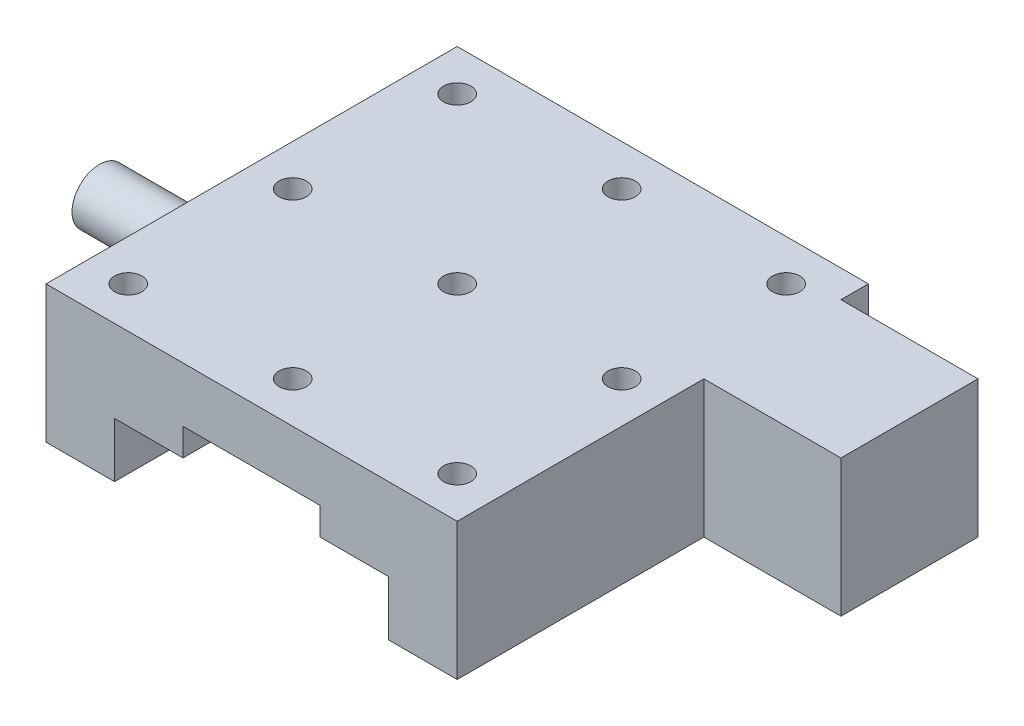
from build123d import *

# Parameters (mm, degrees)
SKETCH_1_W          = 30
SKETCH_1_H          = 30
EXTRUDE_1_DEPTH     = 10
CUT_EXTRUDE_1_DEPTH = 44.588989435
SKETCH_3_R          = 1
CUT_EXTRUDE_2_DEPTH = 3
SKETCH_4_W          = 10
SKETCH_4_H          = 10
EXTRUDE_2_DEPTH     = 10
SKETCH_5_R          = 1
EXTRUDE_3_DEPTH     = 1.6
SKETCH_6_R          = 2
EXTRUDE_4_DEPTH     = 6


with BuildPart() as part:
    # Эскиз1 → Бобышка-Вытянуть1 (new body)
    with BuildSketch(Plane(origin=(0, 0, 0), x_dir=(1, 0, 0), z_dir=(0, 1, 0))):
        with Locations((15, 15)):
            Rectangle(SKETCH_1_W, SKETCH_1_H)
    extrude(amount=EXTRUDE_1_DEPTH)

    # Эскиз2 → Вырез-Вытянуть1 (cut, through all)
    with BuildSketch(Plane.XY):
        Polygon((5, 0), (5, 4), (10, 4), (10, 6), (20, 6), (20, 4), (25, 4), (25, 0), align=None)
    extrude(amount=-CUT_EXTRUDE_1_DEPTH, mode=Mode.SUBTRACT)

    # Эскиз3 → Вырез-Вытянуть2 (cut)
    with BuildSketch(Plane(origin=(0, 10, 0), x_dir=(1, 0, 0), z_dir=(0, 1, 0))):
        with Locations(Location((3, 27, 0), (0, 0, 270))):
            Circle(SKETCH_3_R)
        with Locations(Location((15, 27, 0), (0, 0, 270))):
            Circle(SKETCH_3_R)
        with Locations(Location((27, 27, 0), (0, 0, 270))):
            Circle(SKETCH_3_R)
        with Locations(Location((27, 15, 0), (0, 0, 270))):
            Circle(SKETCH_3_R)
        with Locations(Location((27, 3, 0), (0, 0, 270))):
            Circle(SKETCH_3_R)
        with Locations(Location((15, 3, 0), (0, 0, 270))):
            Circle(SKETCH_3_R)
        with Locations(Location((3, 3, 0), (0, 0, 270))):
            Circle(SKETCH_3_R)
        with Locations(Location((3, 15, 0), (0, 0, 270))):
            Circle(SKETCH_3_R)
        with Locations(Location((15, 15, 0), (0, 0, 270))):
            Circle(SKETCH_3_R)
    extrude(amount=-CUT_EXTRUDE_2_DEPTH, mode=Mode.SUBTRACT)

    # Эскиз4 → Бобышка-Вытянуть2 (add)
    with BuildSketch(Plane(origin=(30, 0, 0), x_dir=(0, 0, -1), z_dir=(1, 0, 0))):
        with Locations((23, 5)):
            Rectangle(SKETCH_4_W, SKETCH_4_H)
    extrude(amount=EXTRUDE_2_DEPTH)

    # Эскиз5 → Бобышка-Вытянуть3 (add)
    with BuildSketch(Plane.ZY):
        with Locations(Location((-11.5, 6, 0), (0, 0, 180))):
            Circle(SKETCH_5_R)
    extrude(amount=EXTRUDE_3_DEPTH)

    # Эскиз6 → Бобышка-Вытянуть4 (add)
    with BuildSketch(Plane.ZY.offset(1.6)):
        with Locations((-11.5, 6)):
            Circle(SKETCH_6_R)
    extrude(amount=EXTRUDE_4_DEPTH)


solid = part.part
